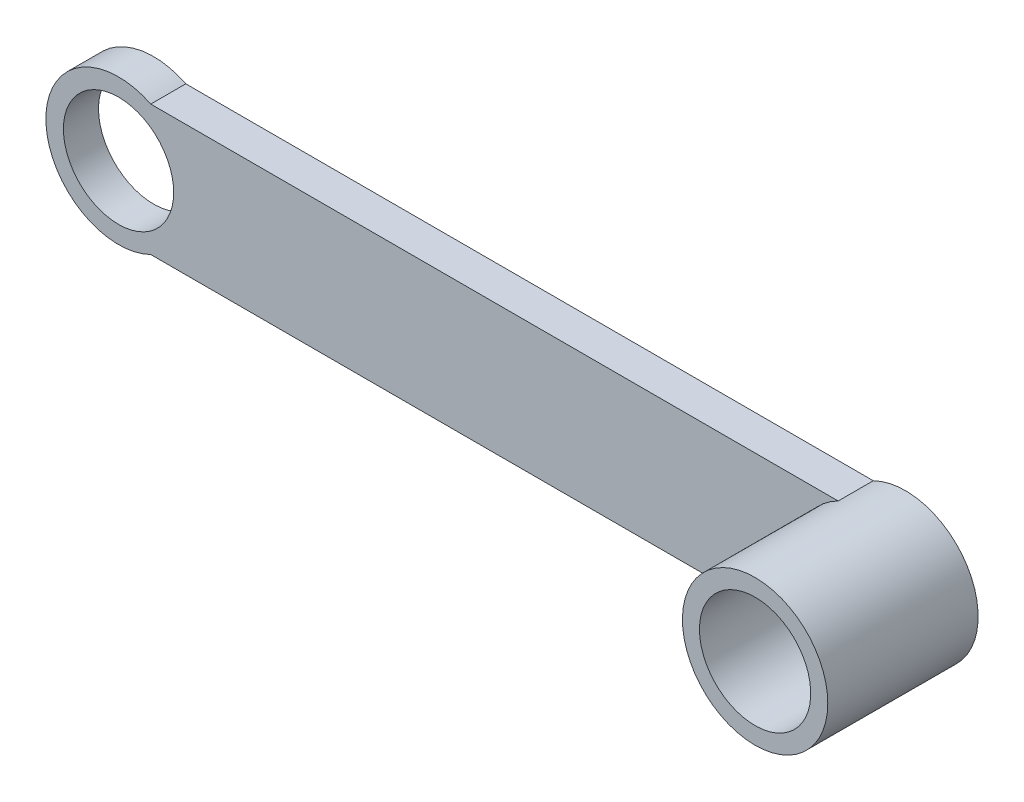
from build123d import *

# Parameters (mm, degrees)
BOSS_EXTRUDE1_DEPTH = 7
SKETCH2_R           = 14.5
BOSS_EXTRUDE2_DEPTH = 23
SKETCH3_R           = 11
CUT_EXTRUDE1_DEPTH  = 96.501308892
CUT_EXTRUDE2_START  = -7
SKETCH4_R           = 11.1
CUT_EXTRUDE2_DEPTH  = 89.501308892


with BuildPart() as part:
    # Sketch1 → Boss-Extrude1 (new body)
    with BuildSketch(Plane.XY):
        with BuildLine():
            Line((-68.577383711, 13), (68.577383711, 13))
            ThreePointArc((68.577383711, 13), (89.5, 0), (68.577383711, -13))
            Line((68.577383711, -13), (-68.577383711, -13))
            ThreePointArc((-68.577383711, -13), (-89.5, 0), (-68.577383711, 13))
        make_face()
    extrude(amount=BOSS_EXTRUDE1_DEPTH)

    # Sketch2 → Boss-Extrude2 (add)
    with BuildSketch(Plane.XY.offset(7)):
        with Locations(Location((75, 0, 0), (0, 0, 116.291555275))):
            Circle(SKETCH2_R)
    extrude(amount=BOSS_EXTRUDE2_DEPTH)

    # Sketch3 → Cut-Extrude1 (cut, through all)
    with BuildSketch(Plane(origin=(0, 0, 0), x_dir=(-1, 0, 0), z_dir=(0, 0, -1))):
        with Locations((-75, 0)):
            Circle(SKETCH3_R)
        with Locations((75, 0)):
            Circle(SKETCH3_R)
    extrude(amount=-CUT_EXTRUDE1_DEPTH, mode=Mode.SUBTRACT)

    # Sketch4 → Cut-Extrude2 (cut, through all)
    with BuildSketch(Plane(origin=(0, 0, 0), x_dir=(-1, 0, 0), z_dir=(0, 0, -1)).offset(CUT_EXTRUDE2_START)):
        with Locations((-75, 0)):
            Circle(SKETCH4_R)
    extrude(amount=-CUT_EXTRUDE2_DEPTH, mode=Mode.SUBTRACT)


solid = part.part
